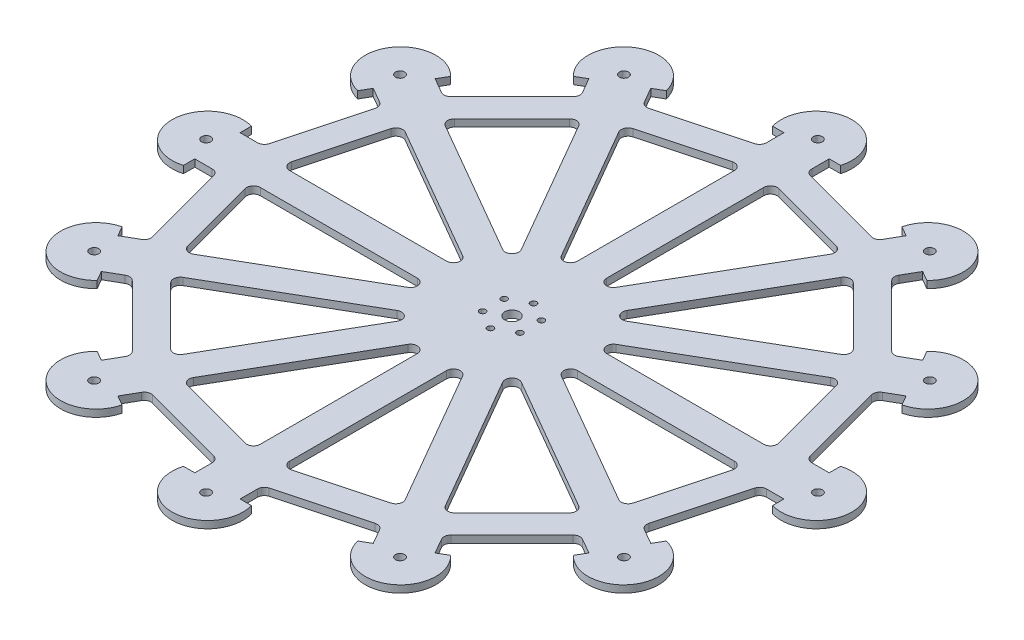
from build123d import *

# Parameters (mm, degrees)
BOSS_EXTRUDE1_DEPTH = 3.18
FILLET1_R           = 3
CIRPATTERN27_COUNT  = 12
SKETCH3_R           = 3.175
CUT_EXTRUDE1_DEPTH  = 213.155868172
SKETCH4_R           = 1.35
CUT_EXTRUDE2_DEPTH  = 213.155868172
SKETCH5_R           = 2
CUT_EXTRUDE3_DEPTH  = 213.155868172
CIRPATTERN28_COUNT  = 12


with BuildPart() as part:
    # Sketch1 → Boss-Extrude1 (new body)
    with BuildSketch(Plane(origin=(0, 0, 0), x_dir=(1, 0, 0), z_dir=(0, 1, 0))):
        with BuildLine():
            Line((0, 0), (0, 150))
            ThreePointArc((0, 150), (12.5, 143.75), (15, 130))
            Line((15, 130), (10, 130))
            Line((10, 130), (10, 120))
            Line((10, 120), (30.669872981, 114.461524227))
            Line((30.669872981, 114.461524227), (27.56404444, 102.870414312))
            Line((27.56404444, 102.870414312), (6.470476128, 108.522418906))
            Line((6.470476128, 108.522418906), (6.470476128, 24.148145657))
            Line((6.470476128, 24.148145657), (0, 0))
        make_face()
    boss_extrude1 = extrude(amount=BOSS_EXTRUDE1_DEPTH)

    # Mirror1: Boss-Extrude1 across plane
    add(boss_extrude1.mirror(Plane(origin=(30.669872981, 3.18, -114.461524227), x_dir=(-0.2588190451025218, 0, 0.965925826289068), z_dir=(-0.9659258262890681, 0, -0.2588190451025218))))

    # Fillet1
    fillet1_edges = [part.edges().sort_by_distance(p)[0] for p in [
        (10, 1.59, -120),
        (6.470476128, 1.59, -108.522418906),
        (6.470476128, 1.59, -24.148145657),
        (51.339745962, 1.59, -108.923048454),
        (48.657612752, 1.59, -97.218409717),
    ]]
    fillet(fillet1_edges, radius=FILLET1_R)


with BuildPart() as cirpattern27_1:
    # CirPattern27: pattern copy
    add(part.part.rotate(Axis((0, 0, 0), (0, 1, 0)), 1 * 360 / CIRPATTERN27_COUNT))


with BuildPart() as cirpattern27_2:
    # CirPattern27: pattern copy
    add(part.part.rotate(Axis((0, 0, 0), (0, 1, 0)), 2 * 360 / CIRPATTERN27_COUNT))


with BuildPart() as cirpattern27_3:
    # CirPattern27: pattern copy
    add(part.part.rotate(Axis((0, 0, 0), (0, 1, 0)), 3 * 360 / CIRPATTERN27_COUNT))


with BuildPart() as cirpattern27_4:
    # CirPattern27: pattern copy
    add(part.part.rotate(Axis((0, 0, 0), (0, 1, 0)), 4 * 360 / CIRPATTERN27_COUNT))


with BuildPart() as cirpattern27_5:
    # CirPattern27: pattern copy
    add(part.part.rotate(Axis((0, 0, 0), (0, 1, 0)), 5 * 360 / CIRPATTERN27_COUNT))


with BuildPart() as cirpattern27_6:
    # CirPattern27: pattern copy
    add(part.part.rotate(Axis((0, 0, 0), (0, 1, 0)), 6 * 360 / CIRPATTERN27_COUNT))


with BuildPart() as cirpattern27_7:
    # CirPattern27: pattern copy
    add(part.part.rotate(Axis((0, 0, 0), (0, 1, 0)), 7 * 360 / CIRPATTERN27_COUNT))


with BuildPart() as cirpattern27_8:
    # CirPattern27: pattern copy
    add(part.part.rotate(Axis((0, 0, 0), (0, 1, 0)), 8 * 360 / CIRPATTERN27_COUNT))


with BuildPart() as cirpattern27_9:
    # CirPattern27: pattern copy
    add(part.part.rotate(Axis((0, 0, 0), (0, 1, 0)), 9 * 360 / CIRPATTERN27_COUNT))


with BuildPart() as cirpattern27_10:
    # CirPattern27: pattern copy
    add(part.part.rotate(Axis((0, 0, 0), (0, 1, 0)), 10 * 360 / CIRPATTERN27_COUNT))


with BuildPart() as cirpattern27_11:
    # CirPattern27: pattern copy
    add(part.part.rotate(Axis((0, 0, 0), (0, 1, 0)), 11 * 360 / CIRPATTERN27_COUNT))


with BuildPart() as cirpattern27_4_1:
    add(cirpattern27_4.part)

    # Combine1: union CirPattern27_3, CirPattern27_2, CirPattern27_1, part, CirPattern27_11, CirPattern27_10, CirPattern27_9, CirPattern27_8, CirPattern27_7, CirPattern27_6, CirPattern27_5
    add(cirpattern27_3.part)
    add(cirpattern27_2.part)
    add(cirpattern27_1.part)
    add(part.part)
    add(cirpattern27_11.part)
    add(cirpattern27_10.part)
    add(cirpattern27_9.part)
    add(cirpattern27_8.part)
    add(cirpattern27_7.part)
    add(cirpattern27_6.part)
    add(cirpattern27_5.part)

    # Sketch3 → Cut-Extrude1 (cut, through all)
    with BuildSketch(Plane(origin=(0, 3.18, 0), x_dir=(1, 0, 0), z_dir=(0, 1, 0))):
        with Locations(Location((0, 0, 0), (0, 0, 270))):
            Circle(SKETCH3_R)
    extrude(amount=-CUT_EXTRUDE1_DEPTH, mode=Mode.SUBTRACT)

    # Sketch4 → Cut-Extrude2 (cut, through all)
    with BuildSketch(Plane(origin=(0, 3.18, 0), x_dir=(1, 0, 0), z_dir=(0, 1, 0))):
        with Locations(Location((0, 9.5, 0), (0, 0, 270))):
            Circle(SKETCH4_R)
        with Locations(Location((8.227241336, 4.75, 0), (0, 0, 270))):
            Circle(SKETCH4_R)
        with Locations(Location((8.227241336, -4.75, 0), (0, 0, 270))):
            Circle(SKETCH4_R)
        with Locations(Location((0, -9.5, 0), (0, 0, 270))):
            Circle(SKETCH4_R)
        with Locations(Location((-8.227241336, -4.75, 0), (0, 0, 270))):
            Circle(SKETCH4_R)
        with Locations(Location((-8.227241336, 4.75, 0), (0, 0, 270))):
            Circle(SKETCH4_R)
    extrude(amount=-CUT_EXTRUDE2_DEPTH, mode=Mode.SUBTRACT)

    # Sketch5 → Cut-Extrude3 (cut, through all)
    with BuildSketch(Plane(origin=(0, 3.18, 0), x_dir=(1, 0, 0), z_dir=(0, 1, 0))):
        with Locations(Location((0, 135, 0), (0, 0, 270))):
            Circle(SKETCH5_R)
    cut_extrude3 = extrude(amount=-CUT_EXTRUDE3_DEPTH, mode=Mode.SUBTRACT)

    # CirPattern28: Cut-Extrude3 ×12 about axis
    cirpattern28_axis = Axis((0, 0, 0), (0, 1, 0))
    for i in range(1, CIRPATTERN28_COUNT):
        add(cut_extrude3.rotate(cirpattern28_axis, i * 360 / CIRPATTERN28_COUNT), mode=Mode.SUBTRACT)


solid = cirpattern27_4_1.part
